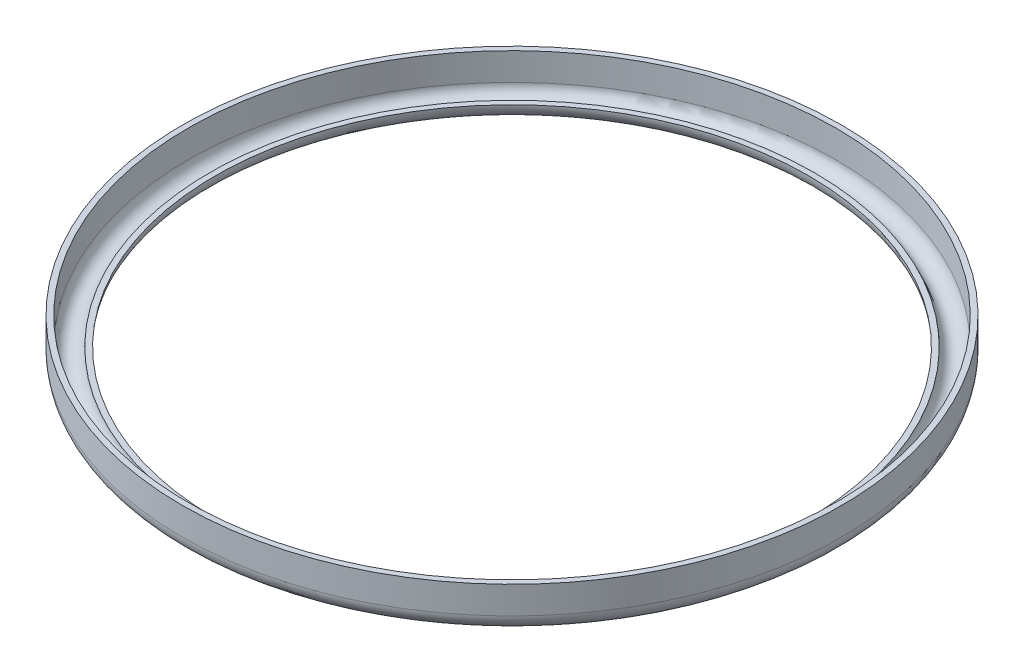
from build123d import *


with BuildPart() as part:
    # Sketch1 → Revolve1 (revolve)
    with BuildSketch(Plane.YZ, mode=Mode.PRIVATE) as revolve1_sk:
        with BuildLine():
            ThreePointArc((0, 59), (-2, 57), (0, 55))
            Line((0, 55), (0, 54))
            ThreePointArc((0, 54), (-3, 57), (0, 60))
            Line((0, 60), (5, 60))
            Line((5, 60), (5, 59))
            Line((5, 59), (0, 59))
        make_face()
    revolve(revolve1_sk.sketch.rotate(Axis((0, -17.054898575, 0), (0, 1, 0)), 180), axis=Axis((0, -17.054898575, 0), (0, 1, 0)))


solid = part.part
